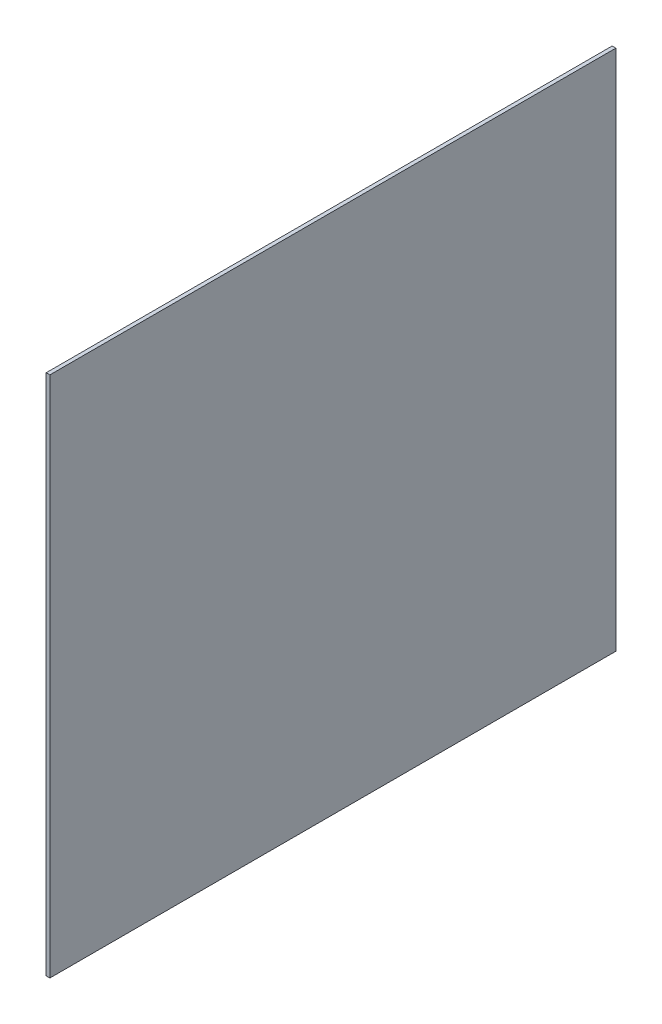
from build123d import *

# Parameters (mm, degrees)
SKETCH1_W           = 457.2
SKETCH1_H           = 422
BOSS_EXTRUDE1_DEPTH = 3


with BuildPart() as part:
    # Sketch1 → Boss-Extrude1 (new body)
    with BuildSketch(Plane(origin=(0, 0, 0), x_dir=(0, 0, -1), z_dir=(1, 0, 0))):
        Rectangle(SKETCH1_W, SKETCH1_H)
    extrude(amount=BOSS_EXTRUDE1_DEPTH)


solid = part.part
